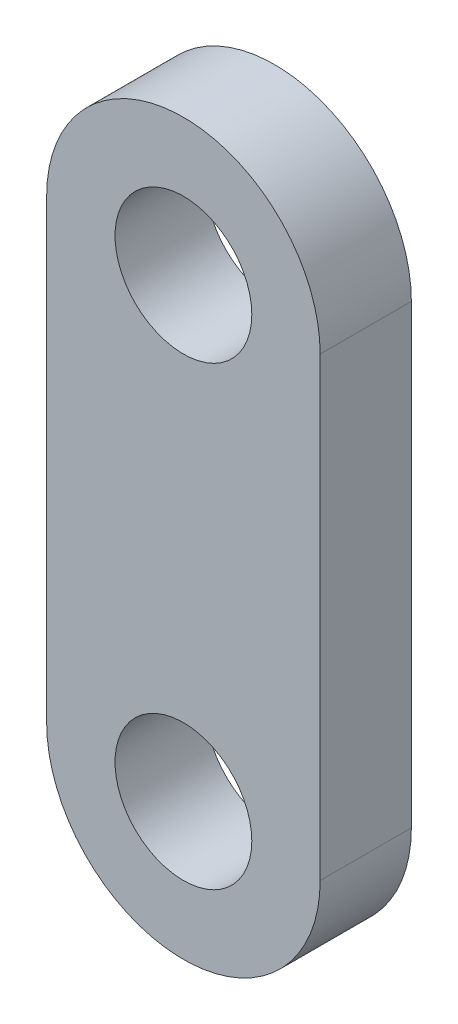
from build123d import *

# Parameters (mm, degrees)
SKETCH_1_R      = 1.5
EXTRUDE_1_DEPTH = 2


with BuildPart() as part:
    # 草图1 → 凸台-拉伸1 (new body)
    with BuildSketch(Plane.XY):
        with BuildLine():
            Line((3, 0), (3, -10))
            ThreePointArc((3, -10), (0, -13), (-3, -10))
            Line((-3, -10), (-3, 0))
            ThreePointArc((-3, 0), (0, 3), (3, 0))
        make_face()
        Circle(SKETCH_1_R, mode=Mode.SUBTRACT)
        with Locations((0, -10)):
            Circle(SKETCH_1_R, mode=Mode.SUBTRACT)
    extrude(amount=EXTRUDE_1_DEPTH)


solid = part.part
